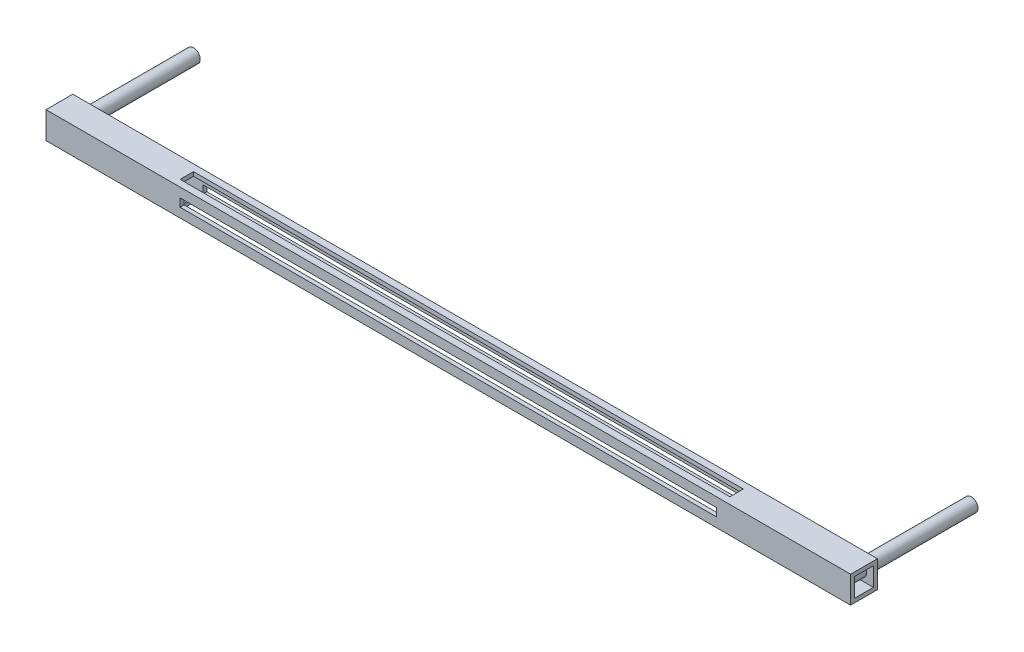
from build123d import *

# Parameters (mm, degrees)
SKETCH13_W          = 10
SKETCH13_H          = 10
SKETCH13_W_2        = 7
SKETCH13_H_2        = 7
BOSS_EXTRUDE1_DEPTH = 300
SKETCH15_W          = 205
SKETCH15_H          = 5
CUT_EXTRUDE1_DEPTH  = 740
SKETCH16_R          = 2.5
BOSS_EXTRUDE3_DEPTH = 50
SKETCH17_W          = 200
SKETCH17_H          = 3
CUT_EXTRUDE2_DEPTH  = 70


with BuildPart() as part:
    # Sketch13 → Boss-Extrude1 (new body)
    with BuildSketch(Plane.YZ):
        Rectangle(SKETCH13_W, SKETCH13_H)
        Rectangle(SKETCH13_W_2, SKETCH13_H_2, mode=Mode.SUBTRACT)
    extrude(amount=BOSS_EXTRUDE1_DEPTH)

    # Sketch15 → Cut-Extrude1 (cut)
    with BuildSketch(Plane(origin=(0, 5, 0), x_dir=(-1, 0, 0), z_dir=(0, 1, 0))):
        with Locations((-150, 0)):
            Rectangle(SKETCH15_W, SKETCH15_H)
    extrude(amount=-CUT_EXTRUDE1_DEPTH, mode=Mode.SUBTRACT)

    # Sketch16 → Boss-Extrude3 (add)
    with BuildSketch(Plane.XY.offset(5)):
        with Locations((5, 0)):
            Circle(SKETCH16_R)
        with Locations((295, 0)):
            Circle(SKETCH16_R)
    extrude(amount=-BOSS_EXTRUDE3_DEPTH)

    # Sketch17 → Cut-Extrude2 (cut)
    with BuildSketch(Plane.XY.offset(5)):
        with Locations((150, 0)):
            Rectangle(SKETCH17_W, SKETCH17_H)
    extrude(amount=-CUT_EXTRUDE2_DEPTH, mode=Mode.SUBTRACT)


solid = part.part
